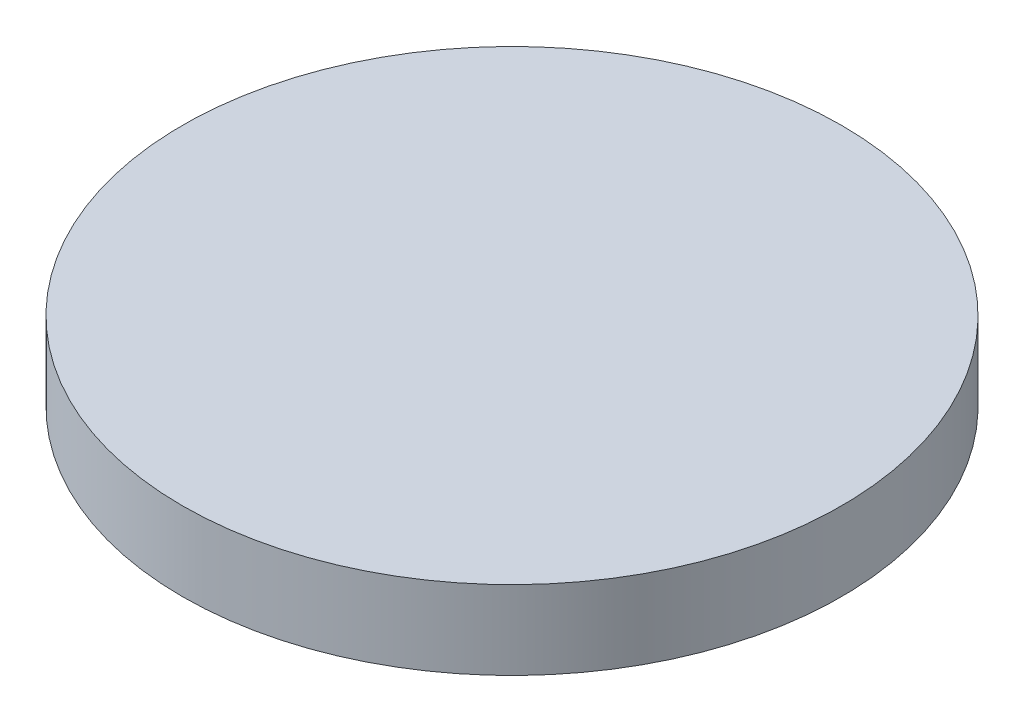
from build123d import *

# Parameters (mm, degrees)
SKETCH1_R           = 42.545
BOSS_EXTRUDE1_DEPTH = 10.16
SHELL1_T            = -1.27


with BuildPart() as part:
    # Sketch1 → Boss-Extrude1 (new body)
    with BuildSketch(Plane(origin=(0, 0, 0), x_dir=(1, 0, 0), z_dir=(0, 1, 0))):
        with Locations(Location((0, 0, 0), (0, 0, 270))):
            Circle(SKETCH1_R)
    extrude(amount=BOSS_EXTRUDE1_DEPTH)

    # Shell1
    shell1_openings = [part.faces().sort_by_distance(p)[0] for p in [
        (0, 0, 0),
    ]]
    offset(amount=SHELL1_T, openings=shell1_openings, kind=Kind.INTERSECTION)


solid = part.part
